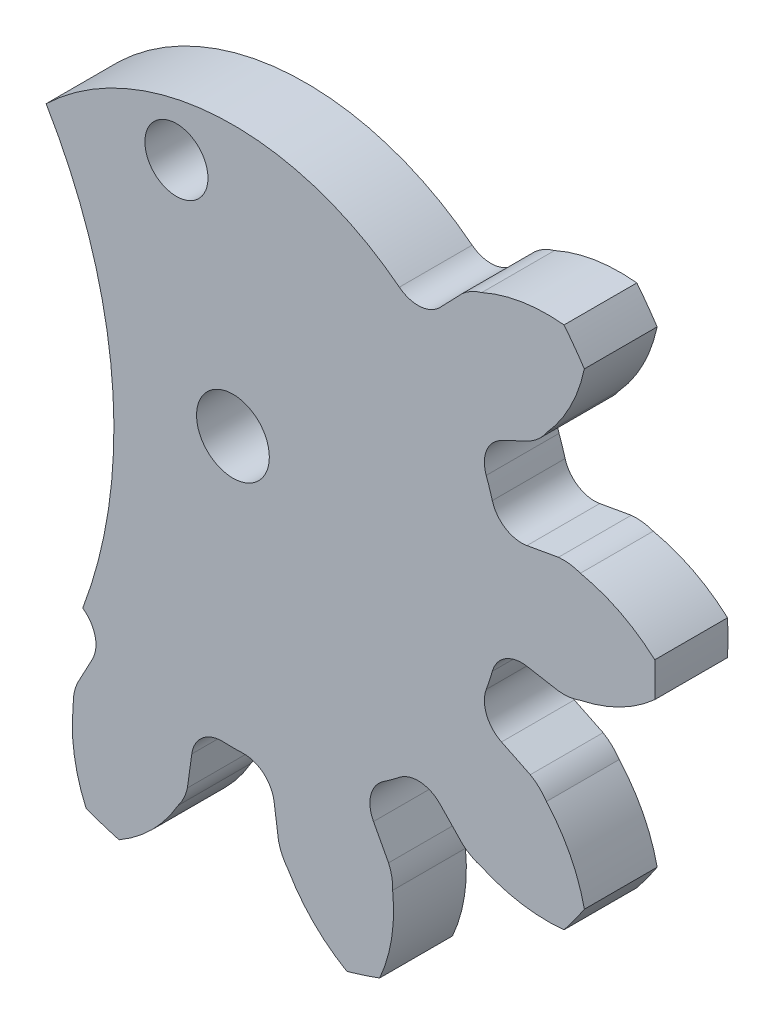
from build123d import *

# Parameters (mm, degrees)
POSICIONAMENTOS_R               = 11.1157
BASE_DEPTH                      = 3
FURO_DE_DI_METRO_2_6_2_6_1_D    = 2.6
BASE_DENTE_DEPTH                = 3
RAIO_DENTE_R                    = 1.254921501
PADR_OCIRCULAR1_COUNT           = 10
RAIO_DENTE_OF_PADR_OCIRCULAR1_R = 1.254921501
FURO_DE_DI_METRO_3_0_3_1_D      = 3
ESBO_O9_R                       = 20
CORTE_EXTRUS_O1_DEPTH           = 25.340719016


with BuildPart() as part:
    # Posicionamentos → Base (new body)
    with BuildSketch(Plane.XY):
        Circle(POSICIONAMENTOS_R)
    extrude(amount=BASE_DEPTH)

    # Furo de diâmetro Ø2.6 (2.6)1 (through all)
    with Locations(Plane.XY.offset(3)):
        with Locations((-2.329371406, 8.693332437)):
            Hole(FURO_DE_DI_METRO_2_6_2_6_1_D / 2)

    # Dente → Base Dente (add, through all)
    with BuildSketch(Plane.XY):
        with BuildLine():
            Line((13.415210536, -2.384858144), (10.944111052, -1.945564126))
            ThreePointArc((10.944111052, -1.945564126), (11.1157, 0), (10.944111052, 1.945564126))
            Line((10.944111052, 1.945564126), (13.415210536, 2.384858144))
            ThreePointArc((13.415210536, 2.384858144), (13.875087923, 2.379001106), (14.321480939, 2.268299743))
            ThreePointArc((14.321480939, 2.268299743), (15.956376882, 1.692474606), (17.385445174, 0.711544868))
            ThreePointArc((17.385445174, 0.711544868), (17.4, 0), (17.385445174, -0.711544868))
            ThreePointArc((17.385445174, -0.711544868), (15.956376882, -1.692474606), (14.321480939, -2.268299743))
            ThreePointArc((14.321480939, -2.268299743), (13.875087923, -2.379001106), (13.415210536, -2.384858144))
        make_face()
    base_dente = extrude(amount=BASE_DENTE_DEPTH)

    # Raio Dente
    raio_dente_edges = [part.edges().sort_by_distance(p)[0] for p in [
        (10.944111052, 1.945564126, 1.5),
        (10.944111052, -1.945564126, 1.5),
    ]]
    fillet(raio_dente_edges, radius=RAIO_DENTE_R)

    # PadrãoCircular1: Base Dente ×10 about axis, 5 skipped
    padr_ocircular1_axis = Axis((0, 0, 0), (0, 0, -1))
    add([base_dente.rotate(padr_ocircular1_axis, i * 360 / PADR_OCIRCULAR1_COUNT) for i in range(1, PADR_OCIRCULAR1_COUNT) if i not in (4, 5, 6, 7, 8)])

    # Raio Dente of PadrãoCircular1
    raio_dente_of_padr_ocircular1_edges = [part.edges().sort_by_distance(p)[0] for p in [
        (9.99754573, -4.858792634, 1.5),
        (7.710397929, -8.006781518, 1.5),
        (5.232257744, -9.807255752, 1.5),
        (1.531574863, -11.00968051, 1.5),
        (-1.531574863, -11.00968051, 1.5),
        (-5.232257744, -9.807255752, 1.5),
        (7.710397929, 8.006781518, 1.5),
        (9.99754573, 4.858792634, 1.5),
    ]]
    fillet(raio_dente_of_padr_ocircular1_edges, radius=RAIO_DENTE_OF_PADR_OCIRCULAR1_R)

    # Furo de diâmetro Ø3.0 (3)1 (through all)
    with Locations(Plane.XY.offset(3)):
        with Locations((0, 0)):
            Hole(FURO_DE_DI_METRO_3_0_3_1_D / 2)

    # Esboço9 → Corte-extrusão1 (cut, through all)
    with BuildSketch(Plane.XY):
        with Locations((-24.904867452, -2.178893569)):
            Circle(ESBO_O9_R)
    extrude(amount=CORTE_EXTRUS_O1_DEPTH, mode=Mode.SUBTRACT)


solid = part.part
